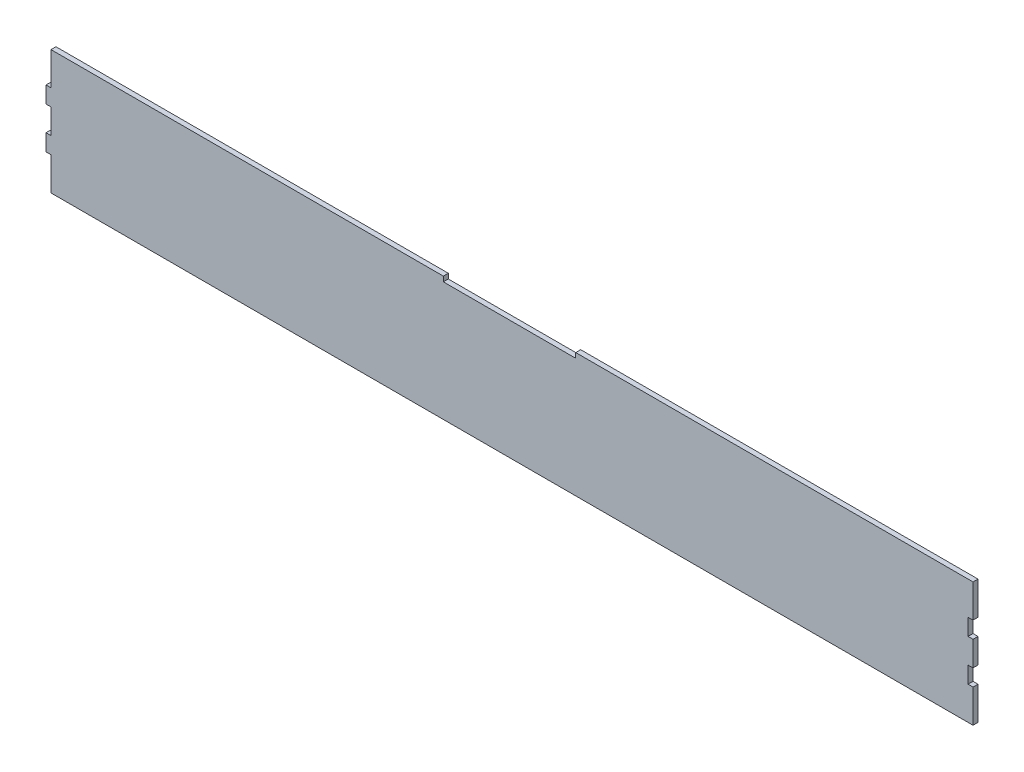
from build123d import *

# Parameters (mm, degrees)
SKETCH1_W           = 560
SKETCH1_H           = 75
BOSS_EXTRUDE1_DEPTH = 3
SKETCH2_W           = 3
SKETCH2_H           = 10
CUT_EXTRUDE1_DEPTH  = 3
SKETCH3_W           = 3
SKETCH3_H           = 20
SKETCH3_H_2         = 15
CUT_EXTRUDE2_DEPTH  = 3
SKETCH4_W           = 80
SKETCH4_H           = 3
CUT_EXTRUDE3_DEPTH  = 3


with BuildPart() as part:
    # Sketch1 → Boss-Extrude1 (new body)
    with BuildSketch(Plane.XY):
        with Locations((47.655062333, 176.988975695)):
            Rectangle(SKETCH1_W, SKETCH1_H)
    extrude(amount=BOSS_EXTRUDE1_DEPTH)

    # Sketch2 → Cut-Extrude1 (cut)
    with BuildSketch(Plane.XY.offset(3)):
        with Locations((326.155062333, 189.488975695)):
            Rectangle(SKETCH2_W, SKETCH2_H)
        with Locations((326.155062333, 164.488975695)):
            Rectangle(SKETCH2_W, SKETCH2_H)
    extrude(amount=-CUT_EXTRUDE1_DEPTH, mode=Mode.SUBTRACT)

    # Sketch3 → Cut-Extrude2 (cut)
    with BuildSketch(Plane.XY.offset(3)):
        with Locations((-230.844937667, 204.488975695)):
            Rectangle(SKETCH3_W, SKETCH3_H)
        with Locations((-230.844937667, 149.488975695)):
            Rectangle(SKETCH3_W, SKETCH3_H)
        with Locations((-230.844937667, 176.988975695)):
            Rectangle(SKETCH3_W, SKETCH3_H_2)
    extrude(amount=-CUT_EXTRUDE2_DEPTH, mode=Mode.SUBTRACT)

    # Sketch4 → Cut-Extrude3 (cut)
    with BuildSketch(Plane.XY.offset(3)):
        with Locations((47.655062333, 212.988975695)):
            Rectangle(SKETCH4_W, SKETCH4_H)
    extrude(amount=-CUT_EXTRUDE3_DEPTH, mode=Mode.SUBTRACT)


solid = part.part
